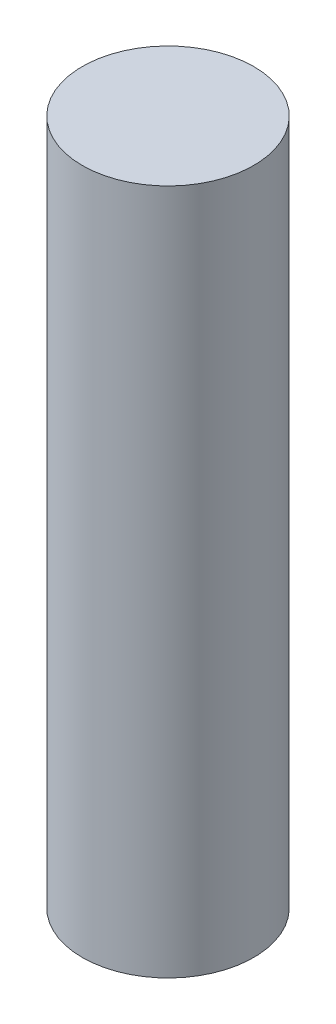
from build123d import *

# Parameters (mm, degrees)
SKETCH_1_R      = 5
EXTRUDE_1_DEPTH = 40


with BuildPart() as part:
    # 스케치1 → 보스-돌출1 (new body)
    with BuildSketch(Plane(origin=(0, 0, 0), x_dir=(1, 0, 0), z_dir=(0, 1, 0))):
        with Locations(Location((0, 0, 0), (0, 0, 270))):
            Circle(SKETCH_1_R)
    extrude(amount=EXTRUDE_1_DEPTH)


solid = part.part
